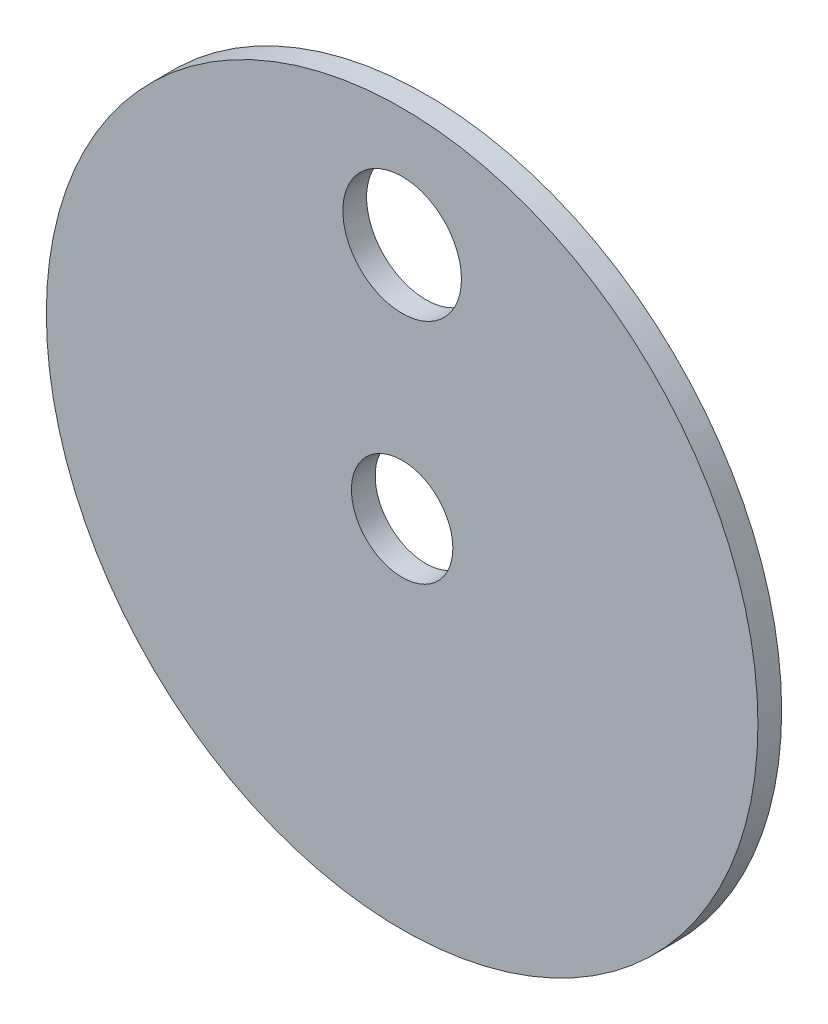
from build123d import *

# Parameters (mm, degrees)
SKETCH1_R           = 150
BOSS_EXTRUDE1_DEPTH = 10
SKETCH2_R           = 21.376176391
SKETCH2_R_2         = 25
CUT_EXTRUDE1_DEPTH  = 10


with BuildPart() as part:
    # Sketch1 → Boss-Extrude1 (new body)
    with BuildSketch(Plane.XY):
        Circle(SKETCH1_R)
    extrude(amount=BOSS_EXTRUDE1_DEPTH)

    # Sketch2 → Cut-Extrude1 (cut)
    with BuildSketch(Plane.XY.offset(10)):
        Circle(SKETCH2_R)
        with Locations((0, 100)):
            Circle(SKETCH2_R_2)
    extrude(amount=-CUT_EXTRUDE1_DEPTH, mode=Mode.SUBTRACT)


solid = part.part
